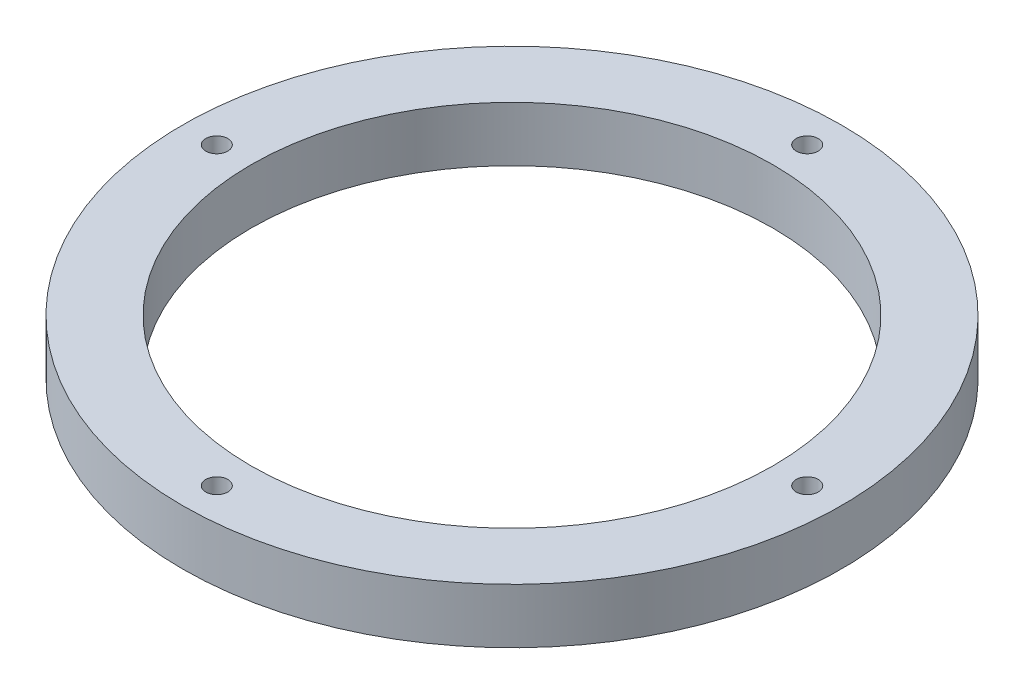
from build123d import *

# Parameters (mm, degrees)
SKETCH1_R           = 60
BOSS_EXTRUDE1_DEPTH = 10
SKETCH2_R           = 47.5
CUT_EXTRUDE1_DEPTH  = 10
SKETCH4_R           = 2
CUT_EXTRUDE2_DEPTH  = 10
CIRPATTERN1_COUNT   = 4


with BuildPart() as part:
    # Sketch1 → Boss-Extrude1 (new body)
    with BuildSketch(Plane(origin=(0, 0, 0), x_dir=(1, 0, 0), z_dir=(0, 1, 0))):
        with Locations(Location((0, 0, 0), (0, 0, 270))):
            Circle(SKETCH1_R)
    extrude(amount=BOSS_EXTRUDE1_DEPTH)

    # Sketch2 → Cut-Extrude1 (cut)
    with BuildSketch(Plane(origin=(0, 10, 0), x_dir=(1, 0, 0), z_dir=(0, 1, 0))):
        with Locations(Location((0, 0, 0), (0, 0, 270))):
            Circle(SKETCH2_R)
    extrude(amount=-CUT_EXTRUDE1_DEPTH, mode=Mode.SUBTRACT)

    # Sketch4 → Cut-Extrude2 (cut)
    with BuildSketch(Plane(origin=(0, 10, 0), x_dir=(1, 0, 0), z_dir=(0, 1, 0))):
        with Locations(Location((0, 53.75, 0), (0, 0, 270))):
            Circle(SKETCH4_R)
    cut_extrude2 = extrude(amount=-CUT_EXTRUDE2_DEPTH, mode=Mode.SUBTRACT)

    # CirPattern1: Cut-Extrude2 ×4 about axis
    cirpattern1_axis = Axis((0, 0, 0), (0, 1, 0))
    for i in range(1, CIRPATTERN1_COUNT):
        add(cut_extrude2.rotate(cirpattern1_axis, i * 360 / CIRPATTERN1_COUNT), mode=Mode.SUBTRACT)


solid = part.part
